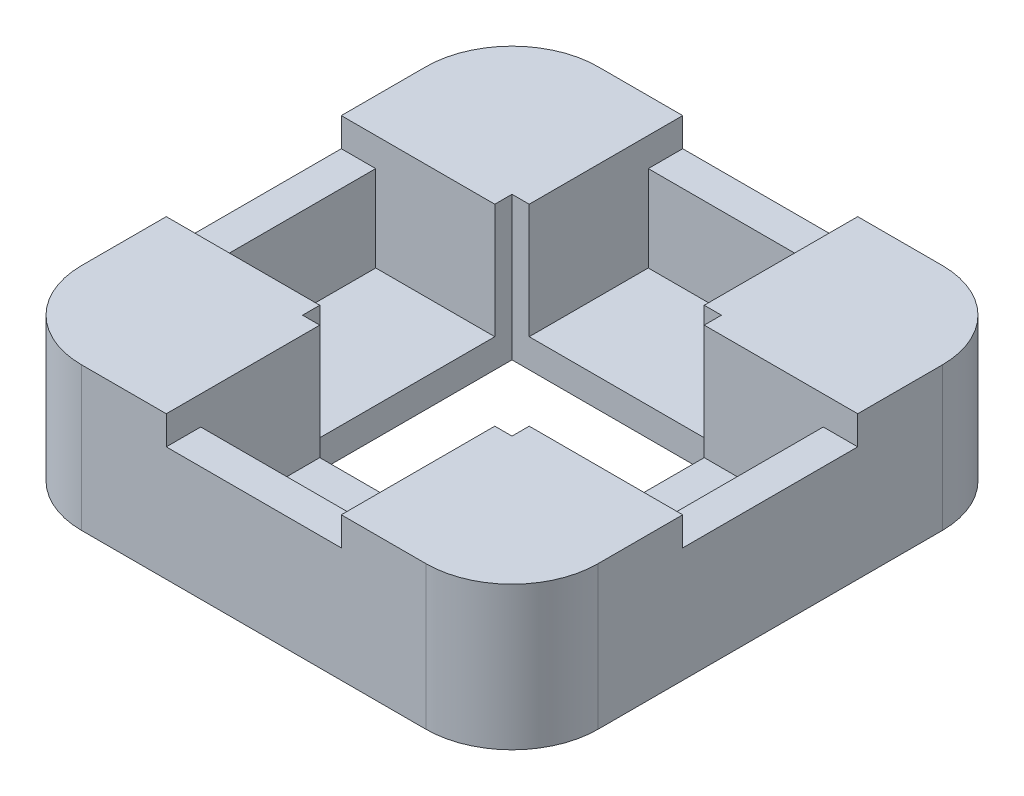
from build123d import *

# Parameters (mm, degrees)
SKETCH1_W           = 7.3
SKETCH1_H           = 7.3
BOSS_EXTRUDE1_DEPTH = 1
BOSS_EXTRUDE2_DEPTH = 3
BOSS_EXTRUDE3_DEPTH = 1


with BuildPart() as part:
    # Sketch1 → Boss-Extrude1 (new body)
    with BuildSketch(Plane(origin=(0, 0, 0), x_dir=(1, 0, 0), z_dir=(0, 1, 0))):
        with BuildLine():
            Line((-6, -9), (6, -9))
            ThreePointArc((6, -9), (8.121320344, -8.121320344), (9, -6))
            Line((9, -6), (9, 6))
            ThreePointArc((9, 6), (8.121320344, 8.121320344), (6, 9))
            Line((6, 9), (-6, 9))
            ThreePointArc((-6, 9), (-8.121320344, 8.121320344), (-9, 6))
            Line((-9, 6), (-9, -6))
            ThreePointArc((-9, -6), (-8.121320344, -8.121320344), (-6, -9))
        make_face()
        Rectangle(SKETCH1_W, SKETCH1_H, mode=Mode.SUBTRACT)
    extrude(amount=BOSS_EXTRUDE1_DEPTH)

    # Sketch2 → Boss-Extrude2 (add)
    with BuildSketch(Plane(origin=(0, 1, 0), x_dir=(1, 0, 0), z_dir=(0, 1, 0))):
        with BuildLine():
            Line((-6, -9), (6, -9))
            ThreePointArc((6, -9), (8.121320344, -8.121320344), (9, -6))
            Line((9, -6), (9, 6))
            ThreePointArc((9, 6), (8.121320344, 8.121320344), (6, 9))
            Line((6, 9), (-6, 9))
            ThreePointArc((-6, 9), (-8.121320344, 8.121320344), (-9, 6))
            Line((-9, 6), (-9, -6))
            ThreePointArc((-9, -6), (-8.121320344, -8.121320344), (-6, -9))
        make_face()
        Polygon((-3.05, -3.65), (-3.05, -7.8), (3.05, -7.8), (3.05, -3.65), (3.65, -3.65), (3.65, -3.05), (7.8, -3.05), (7.8, 3.05), (3.65, 3.05), (3.65, 3.65), (3.05, 3.65), (3.05, 7.8), (-3.05, 7.8), (-3.05, 3.65), (-3.65, 3.65), (-3.65, 3.05), (-7.8, 3.05), (-7.8, -3.05), (-3.65, -3.05), (-3.65, -3.65), align=None, mode=Mode.SUBTRACT)
    extrude(amount=BOSS_EXTRUDE2_DEPTH)

    # Sketch3 → Boss-Extrude3 (add)
    with BuildSketch(Plane(origin=(0, 4, 0), x_dir=(1, 0, 0), z_dir=(0, 1, 0))):
        with BuildLine():
            Line((-3.65, -3.05), (-3.65, -3.65))
            Line((-3.65, -3.65), (-3.05, -3.65))
            Line((-3.05, -3.65), (-3.05, -9))
            Line((-3.05, -9), (-6, -9))
            ThreePointArc((-6, -9), (-8.121320344, -8.121320344), (-9, -6))
            Line((-9, -6), (-9, -3.05))
            Line((-9, -3.05), (-3.65, -3.05))
        make_face()
        with BuildLine():
            Line((6, -9), (3.05, -9))
            Line((3.05, -9), (3.05, -3.65))
            Line((3.05, -3.65), (3.65, -3.65))
            Line((3.65, -3.65), (3.65, -3.05))
            Line((3.65, -3.05), (9, -3.05))
            Line((9, -3.05), (9, -6))
            ThreePointArc((9, -6), (8.121320344, -8.121320344), (6, -9))
        make_face()
        with BuildLine():
            Line((3.65, 3.05), (3.65, 3.65))
            Line((3.65, 3.65), (3.05, 3.65))
            Line((3.05, 3.65), (3.05, 9))
            Line((3.05, 9), (6, 9))
            ThreePointArc((6, 9), (8.121320344, 8.121320344), (9, 6))
            Line((9, 6), (9, 3.05))
            Line((9, 3.05), (3.65, 3.05))
        make_face()
        with BuildLine():
            Line((-6, 9), (-3.05, 9))
            Line((-3.05, 9), (-3.05, 3.65))
            Line((-3.05, 3.65), (-3.65, 3.65))
            Line((-3.65, 3.65), (-3.65, 3.05))
            Line((-3.65, 3.05), (-9, 3.05))
            Line((-9, 3.05), (-9, 6))
            ThreePointArc((-9, 6), (-8.121320344, 8.121320344), (-6, 9))
        make_face()
    extrude(amount=BOSS_EXTRUDE3_DEPTH)


solid = part.part
